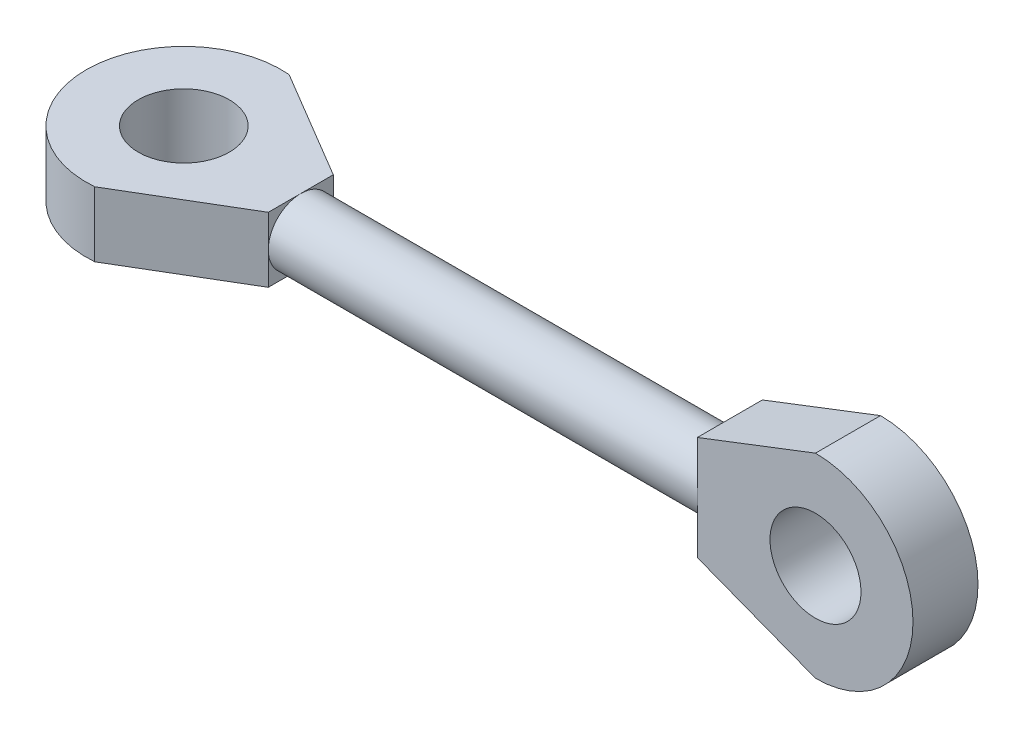
from build123d import *

# Parameters (mm, degrees)
BOSS_EXTRUDE2_DEPTH = 2.5
SKETCH4_R           = 2.5
BOSS_EXTRUDE3_DEPTH = 33.000000000000014
SKETCH8_R           = 3.5000000000000004
BOSS_EXTRUDE4_DEPTH = 2.5


with BuildPart() as part:
    # Sketch1 → Boss-Extrude2 (new, symmetric)
    with BuildSketch(Plane.XY):
        with BuildLine():
            ThreePointArc((7.5, -3.5307e-13), (5.303300858899232, 5.303300858898982), (1.36e-15, 7.500000000000001))
            Line((0, 7.5), (-9.088423691387959, 4))
            Line((-9.088423691387959, 4), (-9.088423691387959, 0))
            Line((-9.088423691387959, 0), (-3.5, 0))
            ThreePointArc((-3.5, 4.3e-16), (2.1e-16, 3.5), (3.5, 0))
            Line((3.5, 0), (7.5, 0))
        make_face()
        with BuildLine():
            ThreePointArc((0, -7.499999999999999), (5.303300858898981, -5.303300858899231), (7.5, -3.5307e-13))
            Line((7.5, 0), (3.5, 0))
            ThreePointArc((3.5, -8.6e-16), (-6.4e-16, -3.5), (-3.5, 4.3e-16))
            Line((-3.5, 0), (-9.088423691387959, 0))
            Line((-9.088423691387959, 0), (-9.088423691387959, -4))
            Line((-9.088423691387959, -4), (0, -7.5))
        make_face()
    extrude(amount=BOSS_EXTRUDE2_DEPTH, both=True)

    # Sketch4 → Boss-Extrude3 (add)
    with BuildSketch(Plane.ZY.offset(9.088423691387959)):
        Circle(SKETCH4_R)
    extrude(amount=BOSS_EXTRUDE3_DEPTH)

    # Sketch8 → Boss-Extrude4 (add, symmetric)
    with BuildSketch(Plane(origin=(0, 0, 0), x_dir=(1, 0, 0), z_dir=(0, 1, 0))):
        with BuildLine():
            Line((-42.08842369138797, 2.5), (-42.08842369138797, -2.5))
            Line((-42.08842369138797, -2.5), (-50.46269365807758, -7.4738518800825435))
            ThreePointArc((-50.46269365807758, -7.4738518800825435), (-58.588423691387945, 9.2e-16), (-50.46269365807758, 7.473851880082519))
            Line((-50.46269365807758, 7.473851880082519), (-42.08842369138797, 2.5))
        make_face()
        with Locations(Location((-51.08842369138797, 0, 0), (0, 0, 270))):
            Circle(SKETCH8_R, mode=Mode.SUBTRACT)
    extrude(amount=BOSS_EXTRUDE4_DEPTH, both=True)


solid = part.part
